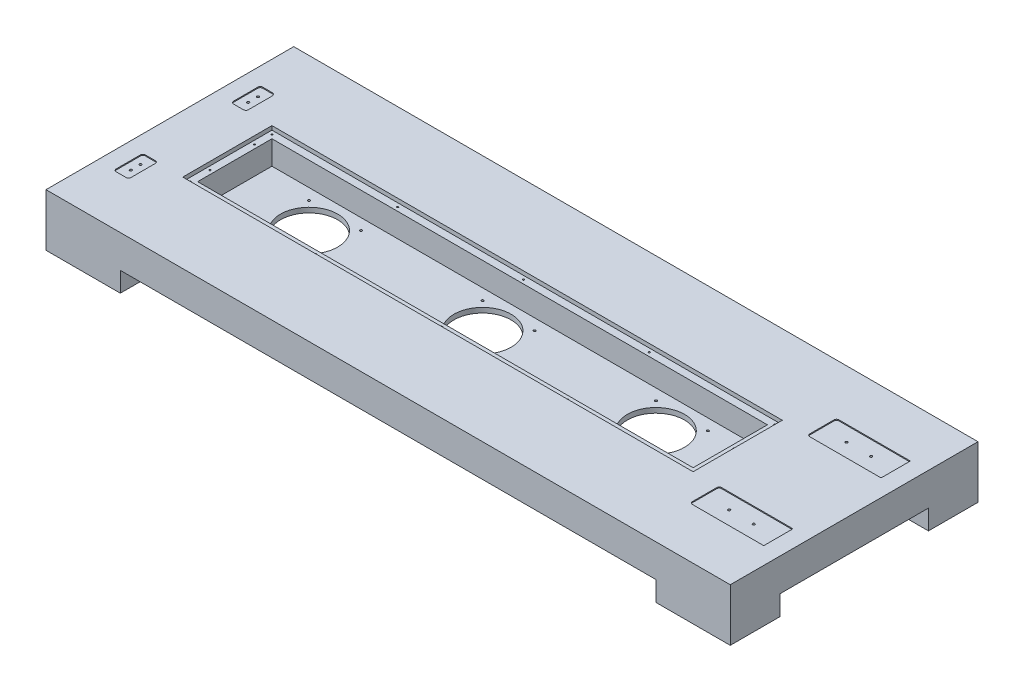
from build123d import *

# Parameters (mm, degrees)
SKETCH19_W               = 1030
SKETCH19_H               = 180
SKETCH19_W_2             = 1000
SKETCH19_H_2             = 150
BOSS_EXTRUDE2_DEPTH      = 48
SKETCH22_W               = 1030
SKETCH22_H               = 180
BOSS_EXTRUDE3_DEPTH      = 10
BOSS_EXTRUDE4_DEPTH      = 56
BOSS_EXTRUDE4_DEPTH_BACK = 10
SKETCH23_W               = 1500
SKETCH23_H               = 500
SKETCH23_W_2             = 1030
SKETCH23_H_2             = 180
CUT_EXTRUDE6_START       = 48
SKETCH26_R               = 1.65
CUT_EXTRUDE6_DEPTH       = 20
LPATTERN1_COUNT          = 5
LPATTERN1_PITCH          = 253.75
SKETCH28_R               = 2.3
SKETCH28_R_2             = 57.7
CUT_EXTRUDE7_DEPTH       = 793.55031386
LPATTERN2_COUNT          = 2
LPATTERN2_PITCH          = 350
LPATTERN2_COL_COUNT      = 2
LPATTERN2_COL_PITCH      = 350
CUT_EXTRUDE8_START       = 48
SKETCH27_R               = 1.65
CUT_EXTRUDE8_DEPTH       = 20
CUT_EXTRUDE9_START       = -56
CUT_EXTRUDE9_DEPTH       = 2
CUT_EXTRUDE10_START      = 56
CUT_EXTRUDE10_DEPTH      = 2
CUT_EXTRUDE11_DEPTH      = 793.55031386
CUT_EXTRUDE11_DEPTH_BACK = 793.55031386
SKETCH33_R               = 2.35
CUT_EXTRUDE12_DEPTH      = 793.55031386
CUT_EXTRUDE12_DEPTH_BACK = 793.55031386
SKETCH34_W               = 190.830831748
SKETCH34_H               = 540.530008981
SKETCH29_W               = 150
SKETCH29_H               = 100
BOSS_EXTRUDE5_DEPTH      = 50


with BuildPart() as part:
    # Sketch19 → Boss-Extrude2 (new body)
    with BuildSketch(Plane(origin=(0, 0, 0), x_dir=(1, 0, 0), z_dir=(0, 1, 0))):
        Rectangle(SKETCH19_W, SKETCH19_H)
        Rectangle(SKETCH19_W_2, SKETCH19_H_2, mode=Mode.SUBTRACT)
    extrude(amount=BOSS_EXTRUDE2_DEPTH)

    # Sketch22 → Boss-Extrude3 (add)
    with BuildSketch(Plane(origin=(0, 0, 0), x_dir=(1, 0, 0), z_dir=(0, 1, 0))):
        Rectangle(SKETCH22_W, SKETCH22_H)
    extrude(amount=-BOSS_EXTRUDE3_DEPTH)

    # Sketch23 → Boss-Extrude4 (add, two sides: drawn at the far end of the back side and taken through both)
    with BuildSketch(Plane(origin=(0, 0, 0), x_dir=(1, 0, 0), z_dir=(0, 1, 0)).offset(-BOSS_EXTRUDE4_DEPTH_BACK)):
        Rectangle(SKETCH23_W, SKETCH23_H)
        Rectangle(SKETCH23_W_2, SKETCH23_H_2, mode=Mode.SUBTRACT)
    extrude(amount=BOSS_EXTRUDE4_DEPTH + BOSS_EXTRUDE4_DEPTH_BACK)

    # Sketch26 → Cut-Extrude6 (cut)
    with BuildSketch(Plane(origin=(0, 0, 0), x_dir=(1, 0, 0), z_dir=(0, 1, 0)).offset(CUT_EXTRUDE6_START)):
        with Locations(Location((-507.5, -82.5, 0), (0, 0, 90))):
            Circle(SKETCH26_R)
        with Locations(Location((-507.5, 82.5, 0), (0, 0, 90))):
            Circle(SKETCH26_R)
    cut_extrude6 = extrude(amount=-CUT_EXTRUDE6_DEPTH, mode=Mode.SUBTRACT)

    # LPattern1: Cut-Extrude6 ×5
    with Locations(*[(i * LPATTERN1_PITCH, 0, 0) for i in range(1, LPATTERN1_COUNT)]):
        add(cut_extrude6, mode=Mode.SUBTRACT)

    # Sketch28 → Cut-Extrude7 (cut, symmetric)
    with BuildSketch(Plane(origin=(0, 0, 0), x_dir=(1, 0, 0), z_dir=(0, 1, 0))):
        with Locations(Location((-52.5, 52.5, 0), (0, 0, 270))):
            Circle(SKETCH28_R)
        with Locations(Location((52.5, 52.5, 0), (0, 0, 270))):
            Circle(SKETCH28_R)
        with Locations(Location((52.5, -52.5, 0), (0, 0, 270))):
            Circle(SKETCH28_R)
        with Locations(Location((-52.5, -52.5, 0), (0, 0, 270))):
            Circle(SKETCH28_R)
        with Locations(Location((0, 0, 0), (0, 0, 270))):
            Circle(SKETCH28_R_2)
    cut_extrude7 = extrude(amount=CUT_EXTRUDE7_DEPTH, both=True, mode=Mode.SUBTRACT)

    # LPattern2: Cut-Extrude7 ×2
    with Locations(*[(-i * LPATTERN2_PITCH, 0, 0) for i in range(1, LPATTERN2_COUNT)]):
        add(cut_extrude7, mode=Mode.SUBTRACT)

    # LPattern2 col: Cut-Extrude7 ×2
    with Locations(*[(i * LPATTERN2_COL_PITCH, 0, 0) for i in range(1, LPATTERN2_COL_COUNT)]):
        add(cut_extrude7, mode=Mode.SUBTRACT)

    # Sketch27 → Cut-Extrude8 (cut)
    with BuildSketch(Plane(origin=(0, 0, 0), x_dir=(1, 0, 0), z_dir=(0, 1, 0)).offset(CUT_EXTRUDE8_START)):
        with Locations(Location((507.5, 0, 0), (0, 0, 90))):
            Circle(SKETCH27_R)
        with Locations(Location((-507.5, 47.503341606, 0), (0, 0, 90))):
            Circle(SKETCH27_R)
        with Locations(Location((-507.5, -42.394481769, 0), (0, 0, 90))):
            Circle(SKETCH27_R)
    extrude(amount=-CUT_EXTRUDE8_DEPTH, mode=Mode.SUBTRACT)

    # Sketch30 → Cut-Extrude9 (cut)
    with BuildSketch(Plane.XZ.offset(CUT_EXTRUDE9_START)):
        with BuildLine():
            Line((571.5, -147.92), (714.5, -147.92))
            ThreePointArc((714.5, -147.92), (715.207106781, -147.627106781), (715.5, -146.92))
            Line((715.5, -146.92), (715.5, -89.92))
            ThreePointArc((715.5, -89.92), (715.207106781, -89.212893219), (714.5, -88.92))
            Line((714.5, -88.92), (571.5, -88.92))
            ThreePointArc((571.5, -88.92), (567.964466094, -90.384466094), (566.5, -93.92))
            Line((566.5, -93.92), (566.5, -142.92))
            ThreePointArc((566.5, -142.92), (567.964466094, -146.455533906), (571.5, -147.92))
        make_face()
    cut_extrude9 = extrude(amount=CUT_EXTRUDE9_DEPTH, mode=Mode.SUBTRACT)

    # Mirror1: Cut-Extrude9 across plane
    add(cut_extrude9.mirror(Plane.XY), mode=Mode.SUBTRACT)

    # Sketch32 → Cut-Extrude10 (cut)
    with BuildSketch(Plane(origin=(0, 0, 0), x_dir=(1, 0, 0), z_dir=(0, 1, 0)).offset(CUT_EXTRUDE10_START)):
        with BuildLine():
            Line((-591.5, 147.92), (-571.5, 147.92))
            ThreePointArc((-571.5, 147.92), (-567.964466094, 146.455533906), (-566.5, 142.92))
            Line((-566.5, 142.92), (-566.5, 93.92))
            ThreePointArc((-566.5, 93.92), (-567.964466094, 90.384466094), (-571.5, 88.92))
            Line((-571.5, 88.92), (-591.5, 88.92))
            ThreePointArc((-591.5, 88.92), (-595.035533906, 90.384466094), (-596.5, 93.92))
            Line((-596.5, 93.92), (-596.5, 142.92))
            ThreePointArc((-596.5, 142.92), (-595.035533906, 146.455533906), (-591.5, 147.92))
        make_face()
    cut_extrude10 = extrude(amount=-CUT_EXTRUDE10_DEPTH, mode=Mode.SUBTRACT)

    # Mirror2: Cut-Extrude10 across plane
    add(cut_extrude10.mirror(Plane.XY), mode=Mode.SUBTRACT)

    # Sketch33 → Cut-Extrude11 (cut, two sides: drawn at the far end of the back side and taken through both)
    with BuildSketch(Plane(origin=(0, 0, 0), x_dir=(1, 0, 0), z_dir=(0, 1, 0)).offset(-CUT_EXTRUDE11_DEPTH_BACK)):
        with Locations(Location((-581.5, 108.58, 0), (0, 0, 270))):
            Circle(SKETCH33_R)
        with Locations(Location((-581.5, -108.59, 0), (0, 0, 270))):
            Circle(SKETCH33_R)
        with Locations(Location((-581.5, 128.25, 0), (0, 0, 270))):
            Circle(SKETCH33_R)
        with Locations(Location((-581.5, -128.26, 0), (0, 0, 270))):
            Circle(SKETCH33_R)
        with Locations(Location((616.17, -118.42, 0), (0, 0, 270))):
            Circle(SKETCH33_R)
        with Locations(Location((665.84, -118.42, 0), (0, 0, 270))):
            Circle(SKETCH33_R)
        with Locations(Location((616.17, 118.42, 0), (0, 0, 270))):
            Circle(SKETCH33_R)
        with Locations(Location((665.84, 118.42, 0), (0, 0, 270))):
            Circle(SKETCH33_R)
    extrude(amount=CUT_EXTRUDE11_DEPTH + CUT_EXTRUDE11_DEPTH_BACK, mode=Mode.SUBTRACT)

    # Sketch34 → Cut-Extrude12 (cut, two sides: drawn at the far end of the back side and taken through both)
    with BuildSketch(Plane(origin=(0, 0, 0), x_dir=(1, 0, 0), z_dir=(0, 1, 0)).offset(-CUT_EXTRUDE12_DEPTH_BACK)):
        with Locations((-726.415415874, 20.265004491)):
            Rectangle(SKETCH34_W, SKETCH34_H)
    extrude(amount=CUT_EXTRUDE12_DEPTH + CUT_EXTRUDE12_DEPTH_BACK, mode=Mode.SUBTRACT)

    # Sketch29 → Boss-Extrude5 (add)
    with BuildSketch(Plane(origin=(0, 0, 0), x_dir=(1, 0, 0), z_dir=(0, 1, 0))):
        with Locations((-556, -200)):
            Rectangle(SKETCH29_W, SKETCH29_H)
        with Locations((-556, 200)):
            Rectangle(SKETCH29_W, SKETCH29_H)
        with Locations((675, -200)):
            Rectangle(SKETCH29_W, SKETCH29_H)
        with Locations((675, 200)):
            Rectangle(SKETCH29_W, SKETCH29_H)
    extrude(amount=-BOSS_EXTRUDE5_DEPTH)


solid = part.part
